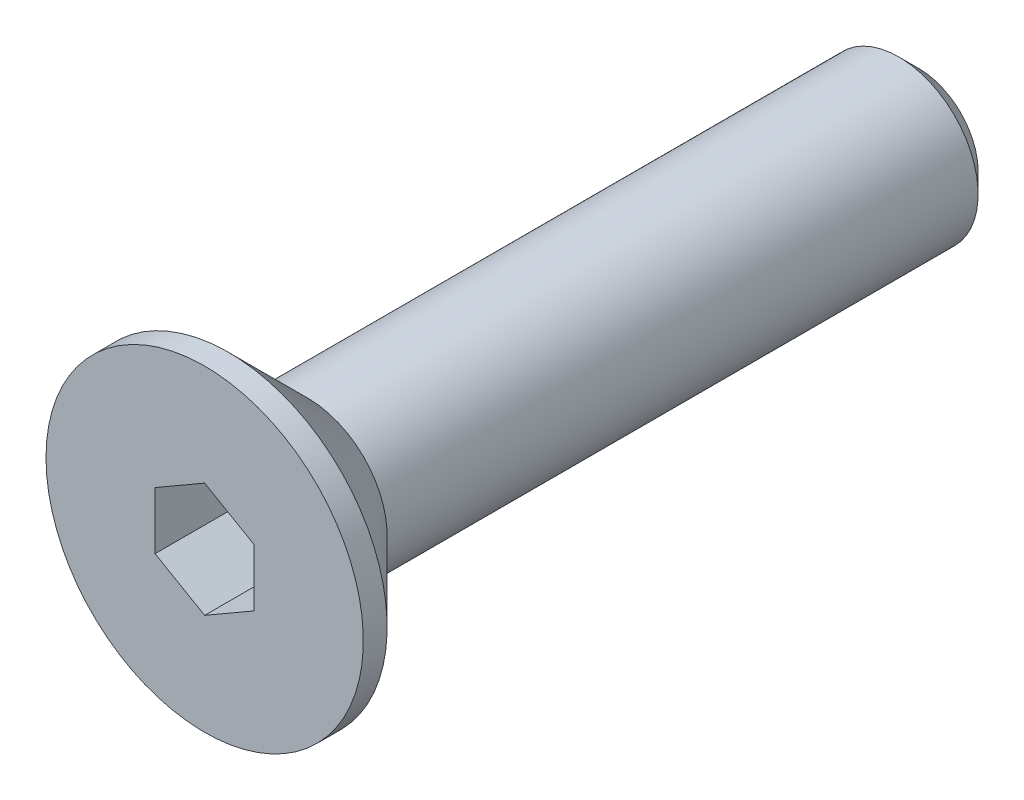
from build123d import *

# Parameters (mm, degrees)
CHAMFER_1_SIZE      = 0.5
CUT_EXTRUDE_1_DEPTH = 2.5


with BuildPart() as part:
    # 草图1 → 旋转1 (revolve)
    with BuildSketch(Plane(origin=(0, 0, 0), x_dir=(0, 0, -1), z_dir=(1, 0, 0)), mode=Mode.PRIVATE) as revolve_1_sk:
        Polygon((-9, 0), (-9, 4), (-8.4, 4), (-6.4, 2), (9, 2), (9, 0), align=None)
    revolve(revolve_1_sk.sketch.rotate(Axis((0, 0, -9), (0, 0, 1)), 90), axis=Axis((0, 0, -9), (0, 0, 1)))

    # 倒角1
    chamfer_1_edges = [part.edges().sort_by_distance(p)[0] for p in [
        (2, 0, -9),
    ]]
    chamfer(chamfer_1_edges, length=CHAMFER_1_SIZE)

    # 草图2 → 切除-拉伸1 (cut)
    with BuildSketch(Plane.XY.offset(9)):
        Polygon((0, 1.443375673), (-1.25, 0.721687836), (-1.25, -0.721687836), (0, -1.443375673), (1.25, -0.721687836), (1.25, 0.721687836), align=None)
    extrude(amount=-CUT_EXTRUDE_1_DEPTH, mode=Mode.SUBTRACT)


solid = part.part
